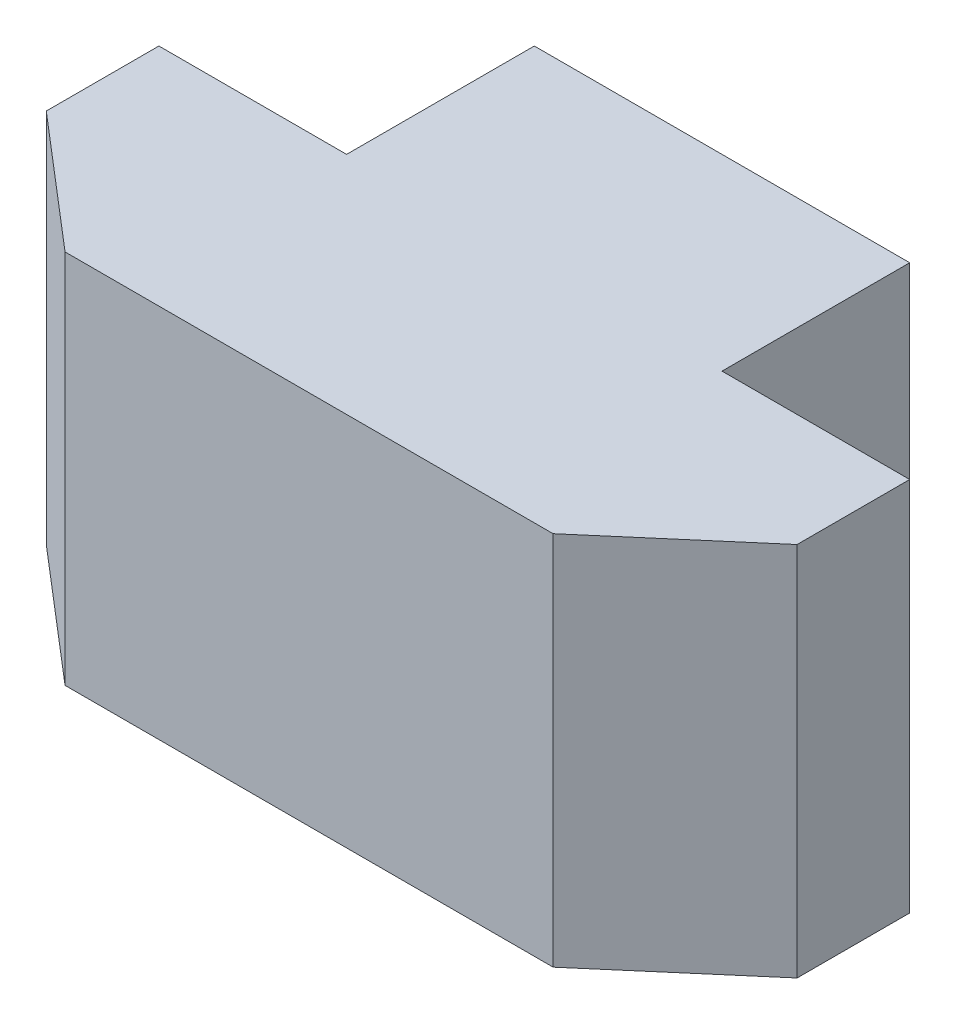
from build123d import *

# Parameters (mm, degrees)
BOSS_EXTRUDE1_DEPTH = 5


with BuildPart() as part:
    # Sketch1 → Boss-Extrude1 (new, symmetric)
    with BuildSketch(Plane(origin=(0, 0, 0), x_dir=(1, 0, 0), z_dir=(0, 1, 0))):
        Polygon((-7.670831542, 1.253243397), (2.329168458, 1.253243397), (2.329168458, -3.746756603), (7.329168458, -3.746756603), (7.329168458, -6.746756603), (3.829168458, -9.746756603), (-9.170831542, -9.746756603), (-12.670831542, -6.746756603), (-12.670831542, -3.746756603), (-7.670831542, -3.746756603), align=None)
    extrude(amount=BOSS_EXTRUDE1_DEPTH, both=True)


solid = part.part
